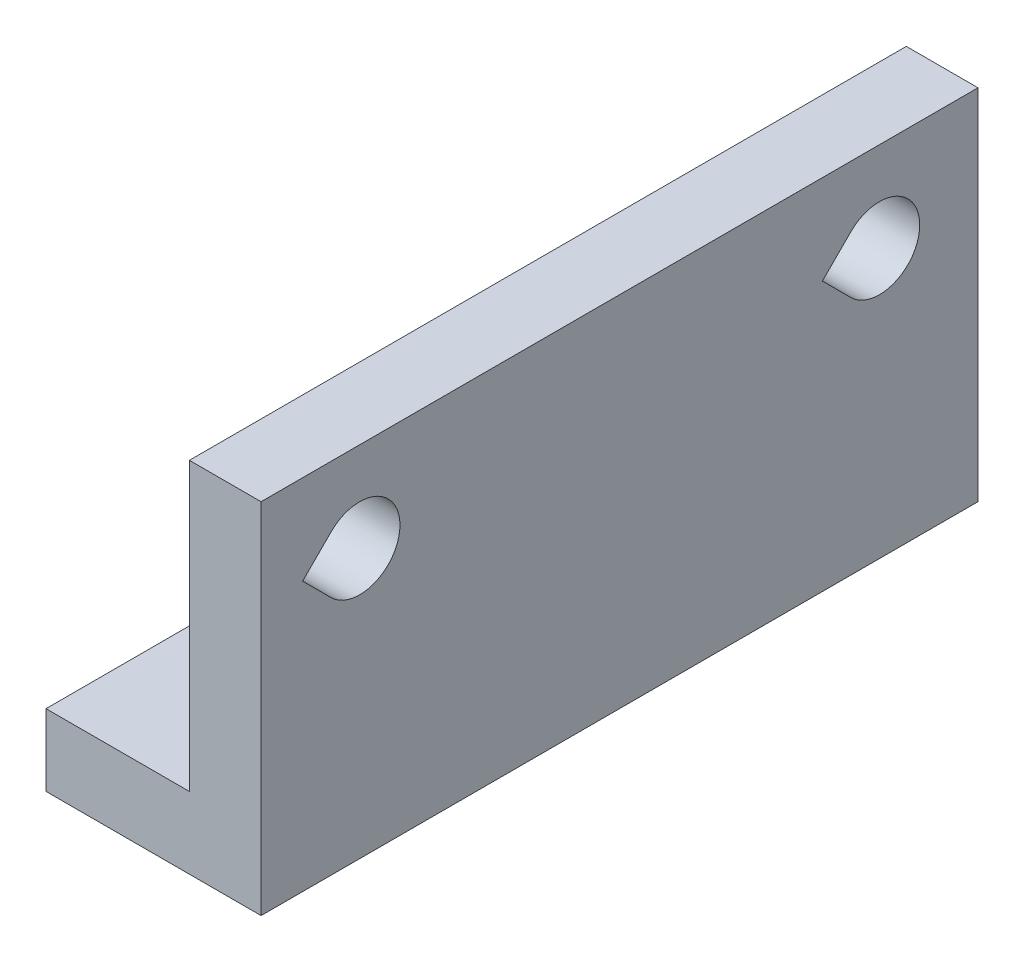
from build123d import *

# Parameters (mm, degrees)
BOSS_EXTRUDE1_DEPTH = 40
CUT_EXTRUDE1_DEPTH  = 46.617978912
CUT_EXTRUDE2_DEPTH  = 50.839743178
SKETCH8_W           = 6
SKETCH8_H           = 40
CUT_EXTRUDE4_DEPTH  = 46.617978912


with BuildPart() as part:
    # Sketch1 → Boss-Extrude1 (new body)
    with BuildSketch(Plane.XY):
        Polygon((-15, 0), (15, 0), (15, 4), (7, 4), (7, 20), (3, 20), (3, 4), (-3, 4), (-3, 20), (-7, 20), (-7, 4), (-15, 4), align=None)
    extrude(amount=BOSS_EXTRUDE1_DEPTH)

    # Sketch2 → Cut-Extrude1 (cut, through all)
    with BuildSketch(Plane(origin=(0, 4, 0), x_dir=(1, 0, 0), z_dir=(0, 1, 0))):
        with BuildLine():
            Line((-12.590990258, -13.590990258), (-11, -15.181980515))
            Line((-11, -15.181980515), (-9.409009742, -13.590990258))
            ThreePointArc((-9.409009742, -13.590990258), (-11, -9.75), (-12.590990258, -13.590990258))
        make_face()
        with BuildLine():
            Line((9.409009742, -13.590990258), (11, -15.181980515))
            Line((11, -15.181980515), (12.590990258, -13.590990258))
            ThreePointArc((12.590990258, -13.590990258), (11, -9.75), (9.409009742, -13.590990258))
        make_face()
    extrude(amount=-CUT_EXTRUDE1_DEPTH, mode=Mode.SUBTRACT)

    # Sketch3 → Cut-Extrude2 (cut, through all)
    with BuildSketch(Plane(origin=(7, 0, 0), x_dir=(0, 0, -1), z_dir=(1, 0, 0))):
        with BuildLine():
            Line((-7.090990258, 16.590990258), (-8.681980515, 15))
            Line((-8.681980515, 15), (-7.090990258, 13.409009742))
            ThreePointArc((-7.090990258, 13.409009742), (-3.25, 15), (-7.090990258, 16.590990258))
        make_face()
        with BuildLine():
            Line((-36.090990258, 16.590990258), (-37.681980515, 15))
            Line((-37.681980515, 15), (-36.090990258, 13.409009742))
            ThreePointArc((-36.090990258, 13.409009742), (-32.25, 15), (-36.090990258, 16.590990258))
        make_face()
    extrude(amount=-CUT_EXTRUDE2_DEPTH, mode=Mode.SUBTRACT)

    # Sketch8 → Cut-Extrude4 (cut, through all)
    with BuildSketch(Plane(origin=(0, 4, 0), x_dir=(1, 0, 0), z_dir=(0, 1, 0))):
        with Locations((0, -20)):
            Rectangle(SKETCH8_W, SKETCH8_H)
    extrude(amount=-CUT_EXTRUDE4_DEPTH, mode=Mode.SUBTRACT)


with BuildPart() as cut_extrude4_piece_1:
    # of the separate pieces the step leaves, piece 1, a body of its own (cut_extrude4_pieces)
    add(part.part.solids().sort_by_distance((-15, 0, 0))[0])


with BuildPart() as cut_extrude4_piece_2:
    # of the separate pieces the step leaves, piece 2, a body of its own (cut_extrude4_pieces)
    add(part.part.solids().sort_by_distance((3, 0, 0))[0])


solid = cut_extrude4_piece_1.part
